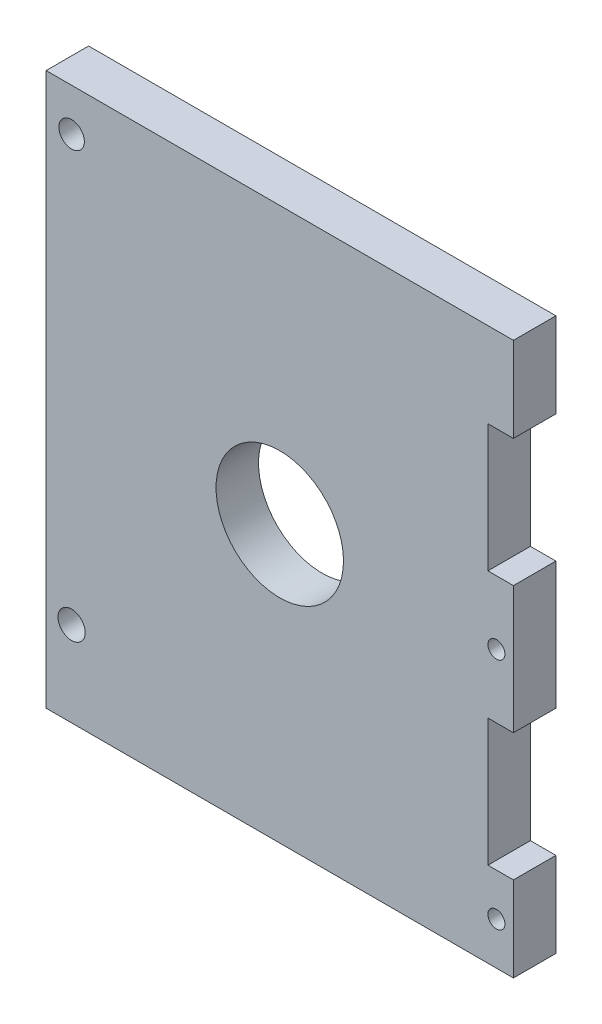
from build123d import *

# Parameters (mm, degrees)
SKETCH_1_W          = 55
SKETCH_1_H          = 65
EXTRUDE_1_DEPTH     = 5
SKETCH_2_W          = 3
SKETCH_2_H          = 15
CUT_EXTRUDE_1_DEPTH = 86.293610546
SKETCH_4_R          = 7.5
CUT_EXTRUDE_2_DEPTH = 86.293610546
SKETCH_5_R          = 1.5
SKETCH_5_R_2        = 1.6
CUT_EXTRUDE_3_DEPTH = 86.293610546
SKETCH_6_R          = 1
CUT_EXTRUDE_4_DEPTH = 86.293610546


with BuildPart() as part:
    # 草图1 → 凸台-拉伸1 (new body)
    with BuildSketch(Plane.XY):
        with Locations((27.5, 32.5)):
            Rectangle(SKETCH_1_W, SKETCH_1_H)
    extrude(amount=EXTRUDE_1_DEPTH)

    # 草图2 → 切除-拉伸1 (cut, through all)
    with BuildSketch(Plane.XY.offset(5)):
        with Locations((53.5, 47.5)):
            Rectangle(SKETCH_2_W, SKETCH_2_H)
        with Locations((53.5, 17.5)):
            Rectangle(SKETCH_2_W, SKETCH_2_H)
    extrude(amount=-CUT_EXTRUDE_1_DEPTH, mode=Mode.SUBTRACT)

    # 草图4 → 切除-拉伸2 (cut, through all)
    with BuildSketch(Plane.XY.offset(5)):
        with Locations((27.5, 32.5)):
            Circle(SKETCH_4_R)
    extrude(amount=-CUT_EXTRUDE_2_DEPTH, mode=Mode.SUBTRACT)

    # 草图5 → 切除-拉伸3 (cut, through all)
    with BuildSketch(Plane.XY.offset(5)):
        with Locations((3, 60)):
            Circle(SKETCH_5_R)
        with Locations((3, 10)):
            Circle(SKETCH_5_R_2)
    extrude(amount=-CUT_EXTRUDE_3_DEPTH, mode=Mode.SUBTRACT)

    # 草图6 → 切除-拉伸4 (cut, through all)
    with BuildSketch(Plane(origin=(0, 0, 0), x_dir=(-1, 0, 0), z_dir=(0, 0, -1))):
        with Locations((-53, 32.5)):
            Circle(SKETCH_6_R)
        with Locations((-53, 5)):
            Circle(SKETCH_6_R)
    extrude(amount=-CUT_EXTRUDE_4_DEPTH, mode=Mode.SUBTRACT)


solid = part.part
